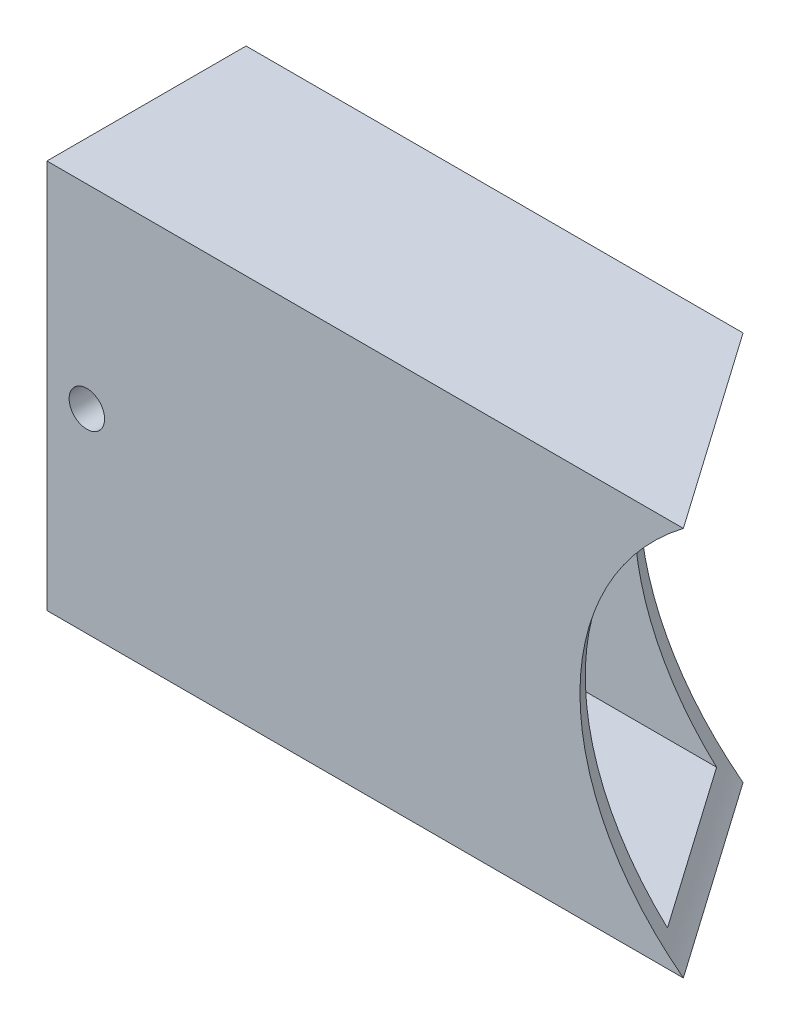
from build123d import *

# Parameters (mm, degrees)
BOSS_EXTRUDE1_DEPTH      = 60
BOSS_EXTRUDE1_DEPTH_BACK = 27
SKETCH1_W                = 22.45
SKETCH1_H                = 43.9
SKETCH1_W_2              = 18.45
SKETCH1_H_2              = 39.9
SKETCH3_W                = 9.697753833
SKETCH3_H                = 9.057928037
SKETCH3_R                = 2
BOSS_EXTRUDE2_DEPTH      = 6
CUT_EXTRUDE1_REACH       = 66.258
SKETCH3_3_R              = 2


with BuildPart() as part:
    # Sketch1 → Boss-Extrude1 (new, two sides: drawn at the far end of the back side and taken through both)
    with BuildSketch(Plane(origin=(0, 0, 0), x_dir=(0, 0, -1), z_dir=(1, 0, 0)).offset(-BOSS_EXTRUDE1_DEPTH_BACK)):
        with Locations((10.58634259, 18.324330998)):
            Rectangle(SKETCH1_W, SKETCH1_H)
        with Locations((10.58634259, 18.324330998)):
            Rectangle(SKETCH1_W_2, SKETCH1_H_2, mode=Mode.SUBTRACT)
    extrude(amount=BOSS_EXTRUDE1_DEPTH + BOSS_EXTRUDE1_DEPTH_BACK)

    # Sketch2 → Cut-Revolve1 (revolve, cut)
    with BuildSketch(Plane(origin=(0, 18.324330998, 0), x_dir=(-1, 0, 0), z_dir=(0, -1, 0))):
        Polygon((-79.85393198, -15.110595304), (-55.279370652, -32.317888394), (-13.19002891, 27.791921119), (-37.764590239, 44.999214209), align=None)
    revolve(axis=Axis((79.85393198, 18.324330998, 15.110595304), (-0.573576436351041, 0, -0.8191520442889954)), mode=Mode.SUBTRACT)

    # Sketch3 → Boss-Extrude2 (add)
    with BuildSketch(Plane.XY.offset(0.63865741)):
        with Locations((-22.151123083, 18.324330997)):
            Rectangle(SKETCH3_W, SKETCH3_H)
        with Locations((-22.5, 18.324330998)):
            Circle(SKETCH3_R, mode=Mode.SUBTRACT)
    extrude(amount=-BOSS_EXTRUDE2_DEPTH)

    # Sketch3<3> → Cut-Extrude1 (cut, up to next)
    with BuildSketch(Plane.XY.offset(0.63865741), mode=Mode.PRIVATE) as cut_extrude1_sk1:
        with Locations((-22.5, 18.324330998)):
            Circle(SKETCH3_3_R)
    cut_extrude1_tool1 = extrude(cut_extrude1_sk1.sketch, amount=-CUT_EXTRUDE1_REACH, mode=Mode.PRIVATE) & part.part
    add(cut_extrude1_tool1.solids().sort_by_distance((-22.5, 18.324331, 0.638657))[0], mode=Mode.SUBTRACT)


solid = part.part
